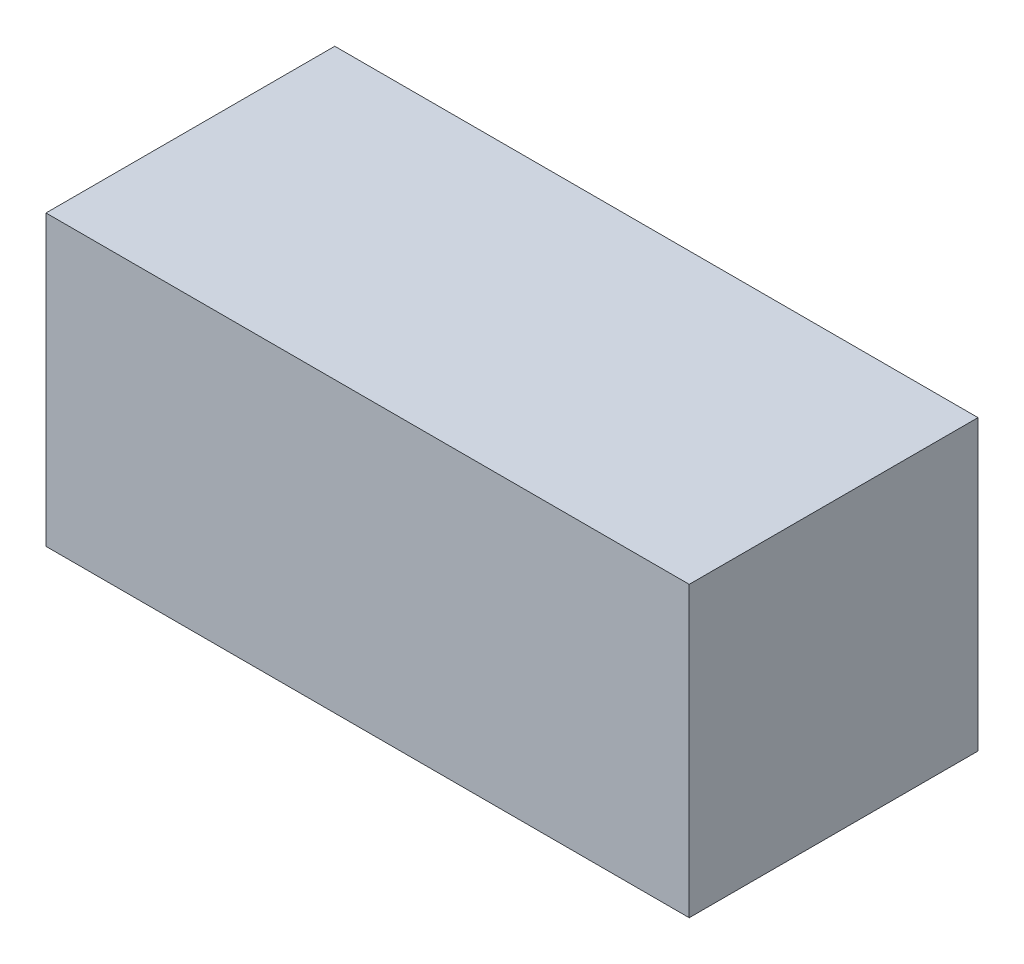
from build123d import *

# Parameters (mm, degrees)
SKETCH_1_W              = 2.2275
SKETCH_1_H              = 1
COMPONENT_OUTLINE_DEPTH = 1


with BuildPart() as part:
    # 草图1 → Component_Outline (new body)
    with BuildSketch(Plane.XY):
        with Locations((0.00125, 0)):
            Rectangle(SKETCH_1_W, SKETCH_1_H)
    extrude(amount=COMPONENT_OUTLINE_DEPTH)


solid = part.part
